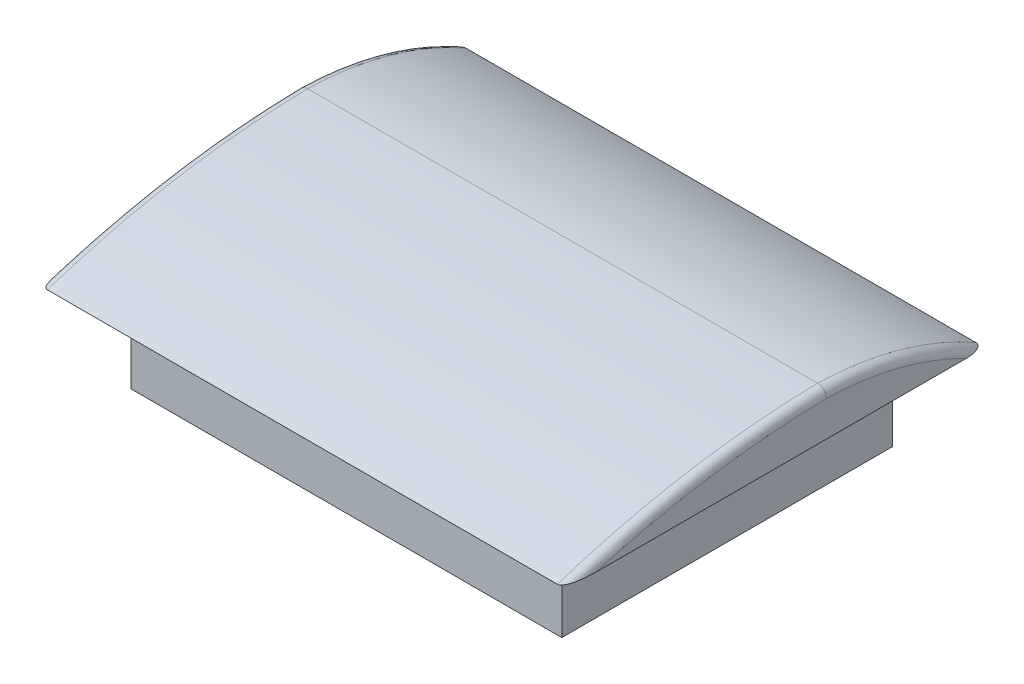
from build123d import *

# Parameters (mm, degrees)
SKETCH1_W                = 124.46
SKETCH1_H                = 95.504
BOSS_EXTRUDE1_DEPTH      = 25.4
BOSS_EXTRUDE2_DEPTH      = 76.2
BOSS_EXTRUDE2_DEPTH_BACK = 76.2
SKETCH4_W                = 114.3
SKETCH4_H                = 85.344
CUT_EXTRUDE1_DEPTH       = 25.4
FILLET3_R                = 2.54


with BuildPart() as part:
    # Sketch1 → Boss-Extrude1 (new body)
    with BuildSketch(Plane(origin=(0, 0, 0), x_dir=(1, 0, 0), z_dir=(0, 1, 0))):
        with Locations((0, -3.048)):
            Rectangle(SKETCH1_W, SKETCH1_H)
    extrude(amount=BOSS_EXTRUDE1_DEPTH)

    # Sketch3 → Boss-Extrude2 (add, two sides: drawn at the far end of the back side and taken through both)
    with BuildSketch(Plane(origin=(0, 0, 0), x_dir=(0, 0, -1), z_dir=(1, 0, 0)).offset(-BOSS_EXTRUDE2_DEPTH_BACK)):
        with BuildLine():
            ThreePointArc((11.684, 38.1), (35.337321444, 34.605957197), (57.404, 25.4))
            Line((57.404, 25.4), (44.704, 25.4))
            Line((44.704, 25.4), (11.684, 25.4))
            Line((11.684, 25.4), (11.684, 38.1))
        make_face()
        with BuildLine():
            ThreePointArc((-63.5, 25.4), (-26.387271572, 34.587287709), (11.684, 38.1))
            Line((11.684, 38.1), (11.684, 25.4))
            Line((11.684, 25.4), (-50.8, 25.4))
            Line((-50.8, 25.4), (-63.5, 25.4))
        make_face()
    extrude(amount=BOSS_EXTRUDE2_DEPTH + BOSS_EXTRUDE2_DEPTH_BACK)

    # Sketch4 → Cut-Extrude1 (cut)
    with BuildSketch(Plane.XZ):
        with Locations((0, 3.048)):
            Rectangle(SKETCH4_W, SKETCH4_H)
    extrude(amount=-CUT_EXTRUDE1_DEPTH, mode=Mode.SUBTRACT)

    # Fillet3
    fillet3_edges = [part.edges().sort_by_distance(p)[0] for p in [
        (76.2, 34.605957197, -35.337321444),
        (76.2, 34.587287709, 26.387271572),
        (-76.2, 34.605957197, -35.337321444),
        (-76.2, 34.587287709, 26.387271572),
    ]]
    fillet(fillet3_edges, radius=FILLET3_R)


solid = part.part
